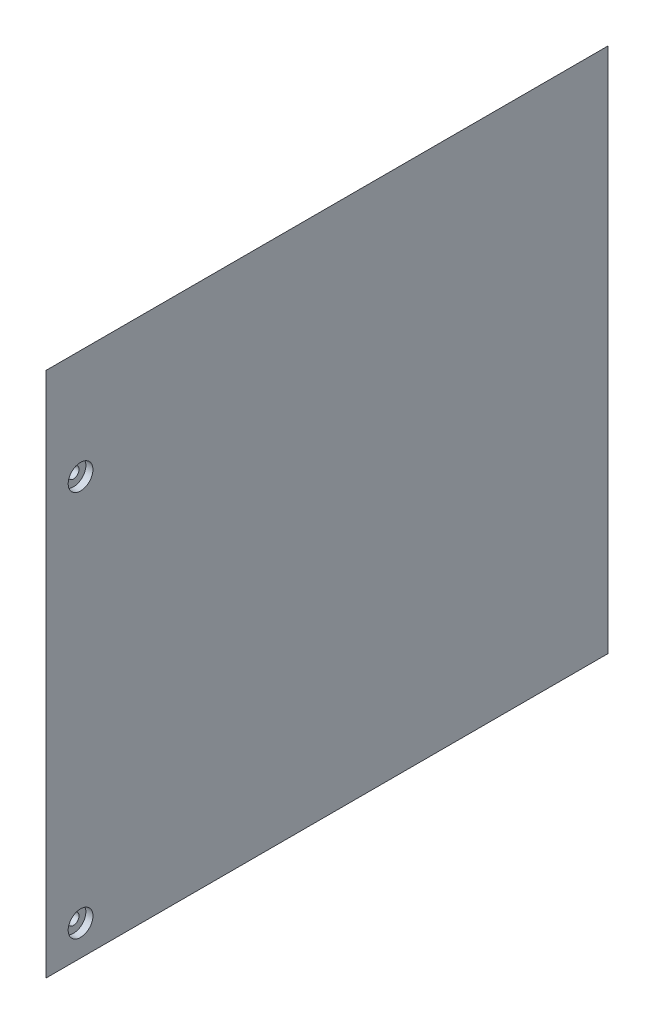
from build123d import *

# Parameters (mm, degrees)
SKETCH1_W                               = 300
SKETCH1_H                               = 260
BOSS_EXTRUDE1_DEPTH                     = 39
CUT_EXTRUDE1_DEPTH                      = 260
CUT_EXTRUDE2_DEPTH                      = 384
F_6_0MM_DOWEL_HOLE1_D                   = 6
F_6_0MM_DOWEL_HOLE1_DEPTH               = 30
F_6_0MM_DOWEL_HOLE1_TIP                 = 1.802581857
CBORE_FOR_M5_HEX_HEAD_BOLT1_D           = 5.5
CBORE_FOR_M5_HEX_HEAD_BOLT1_DEPTH       = 30
CBORE_FOR_M5_HEX_HEAD_BOLT1_CBORE_D     = 12.238
CBORE_FOR_M5_HEX_HEAD_BOLT1_CBORE_DEPTH = 3.5
CBORE_FOR_M5_HEX_HEAD_BOLT1_TIP         = 1.652366702
F_6_0MM_DOWEL_HOLE2_D                   = 6
F_6_0MM_DOWEL_HOLE2_DEPTH               = 30
F_6_0MM_DOWEL_HOLE2_TIP                 = 1.802581857


with BuildPart() as part:
    # Sketch1 → Boss-Extrude1 (new body)
    with BuildSketch(Plane(origin=(0, 0, 0), x_dir=(0, 0, -1), z_dir=(1, 0, 0))):
        Rectangle(SKETCH1_W, SKETCH1_H)
    extrude(amount=BOSS_EXTRUDE1_DEPTH)

    # Sketch3 → Cut-Extrude1 (cut)
    with BuildSketch(Plane(origin=(0, -130, 0), x_dir=(-1, 0, 0), z_dir=(0, -1, 0))):
        Polygon((-39, 150), (0, 150), (0, 111), align=None)
        Polygon((0, -127.51), (0, -88.51), (-39, -127.51), (-39, -150), (0, -150), align=None)
    extrude(amount=-CUT_EXTRUDE1_DEPTH, mode=Mode.SUBTRACT)

    # Sketch5 → Cut-Extrude2 (cut)
    with BuildSketch(Plane(origin=(0, 0, -150), x_dir=(-1, 0, 0), z_dir=(0, 0, -1))):
        Polygon((-39, 130), (0, 130), (0, 91), align=None)
    extrude(amount=-CUT_EXTRUDE2_DEPTH, mode=Mode.SUBTRACT)

    # Ø6.0mm Dowel Hole1
    with Locations(Plane.ZY):
        with Locations((-133, -115), (-133, 76)):
            Hole(F_6_0MM_DOWEL_HOLE1_D / 2, depth=F_6_0MM_DOWEL_HOLE1_DEPTH)
            with Locations((0, 0, -(F_6_0MM_DOWEL_HOLE1_DEPTH + F_6_0MM_DOWEL_HOLE1_TIP / 2))):  # 118° drill point
                Cone(0, F_6_0MM_DOWEL_HOLE1_D / 2, F_6_0MM_DOWEL_HOLE1_TIP, mode=Mode.SUBTRACT)

    # CBORE for M5 Hex Head Bolt1
    with Locations(Plane(origin=(39, 0, 0), x_dir=(0, 0, -1), z_dir=(1, 0, 0))):
        with Locations((-110.51, -115), (-110.51, 76)):
            CounterBoreHole(CBORE_FOR_M5_HEX_HEAD_BOLT1_D / 2, CBORE_FOR_M5_HEX_HEAD_BOLT1_CBORE_D / 2, CBORE_FOR_M5_HEX_HEAD_BOLT1_CBORE_DEPTH, depth=CBORE_FOR_M5_HEX_HEAD_BOLT1_DEPTH)
            with Locations((0, 0, -(CBORE_FOR_M5_HEX_HEAD_BOLT1_DEPTH + CBORE_FOR_M5_HEX_HEAD_BOLT1_TIP / 2))):  # 118° drill point
                Cone(0, CBORE_FOR_M5_HEX_HEAD_BOLT1_D / 2, CBORE_FOR_M5_HEX_HEAD_BOLT1_TIP, mode=Mode.SUBTRACT)

    # Ø6.0mm Dowel Hole2
    with Locations(Plane(origin=(0, 130, 0), x_dir=(1, 0, 0), z_dir=(0, 1, 0))):
        with Locations((25, -95.51), (25, 118)):
            Hole(F_6_0MM_DOWEL_HOLE2_D / 2, depth=F_6_0MM_DOWEL_HOLE2_DEPTH)
            with Locations((0, 0, -(F_6_0MM_DOWEL_HOLE2_DEPTH + F_6_0MM_DOWEL_HOLE2_TIP / 2))):  # 118° drill point
                Cone(0, F_6_0MM_DOWEL_HOLE2_D / 2, F_6_0MM_DOWEL_HOLE2_TIP, mode=Mode.SUBTRACT)


solid = part.part
